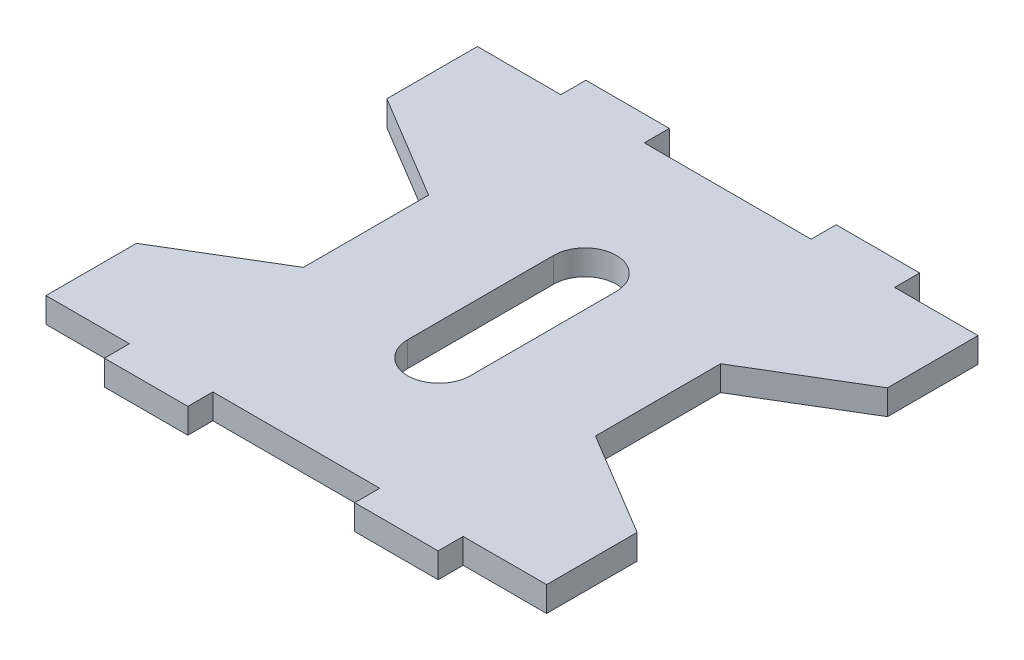
from build123d import *

# Parameters (mm, degrees)
EXTRUDE_1_DEPTH = 3


with BuildPart() as part:
    # 草图2 → 凸台-拉伸1 (new body)
    with BuildSketch(Plane(origin=(0, 0, 0), x_dir=(1, 0, 0), z_dir=(0, 1, 0))):
        Polygon((17.5, -7.5), (17.5, 7.5), (30, 15), (30, 25.85), (20, 25.85), (20, 28.85), (10, 28.85), (10, 25.85), (-10, 25.85), (-10, 28.85), (-20, 28.85), (-20, 25.85), (-30, 25.85), (-30, 15), (-17.5, 7.5), (-17.5, -7.5), (-30, -15), (-30, -25.85), (-20, -25.85), (-20, -28.85), (-10, -28.85), (-10, -25.85), (10, -25.85), (10, -28.85), (20, -28.85), (20, -25.85), (30, -25.85), (30, -15), align=None)
        with BuildLine():
            Line((-3.75, 8.75), (-3.75, -8.75))
            ThreePointArc((-3.75, -8.75), (0, -12.5), (3.75, -8.75))
            Line((3.75, -8.75), (3.75, 8.75))
            ThreePointArc((3.75, 8.75), (0, 12.5), (-3.75, 8.75))
        make_face(mode=Mode.SUBTRACT)
    extrude(amount=EXTRUDE_1_DEPTH)


solid = part.part
